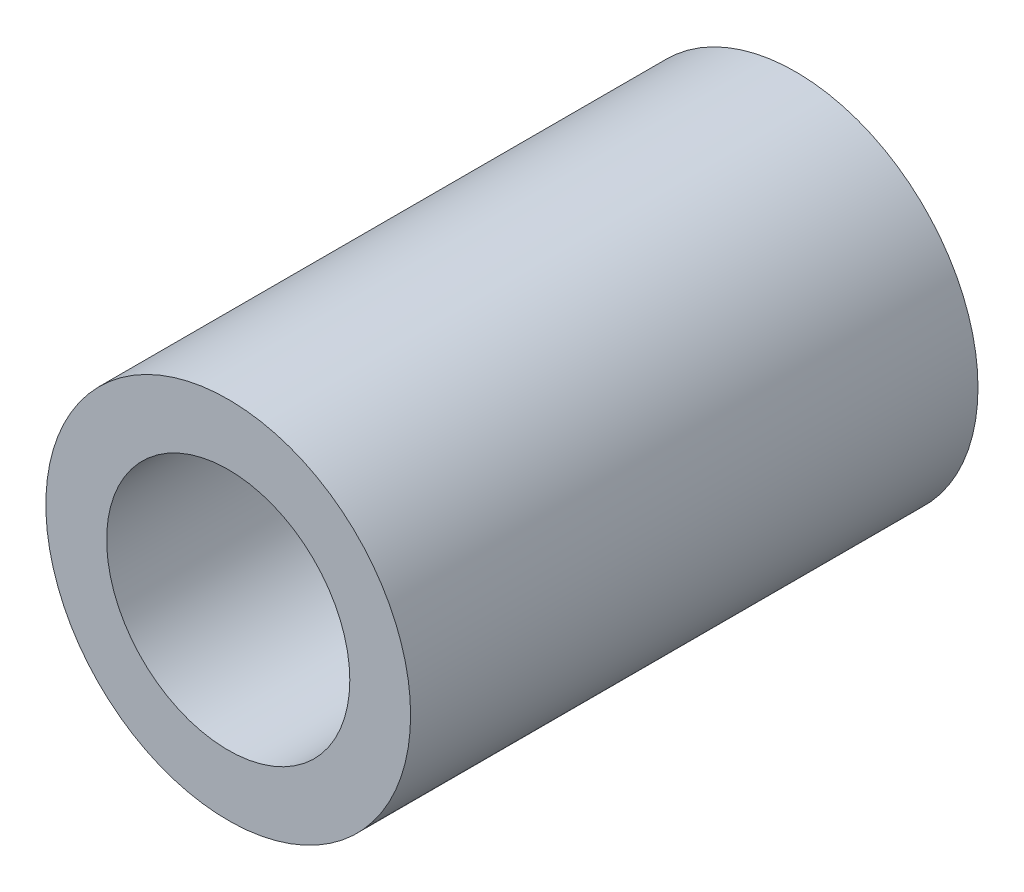
from build123d import *

# Parameters (mm, degrees)
SKETCH1_R           = 2.25
SKETCH1_R_2         = 1.5
BOSS_EXTRUDE1_DEPTH = 7


with BuildPart() as part:
    # Sketch1 → Boss-Extrude1 (new body)
    with BuildSketch(Plane.XY):
        Circle(SKETCH1_R)
        Circle(SKETCH1_R_2, mode=Mode.SUBTRACT)
    extrude(amount=BOSS_EXTRUDE1_DEPTH)


solid = part.part
